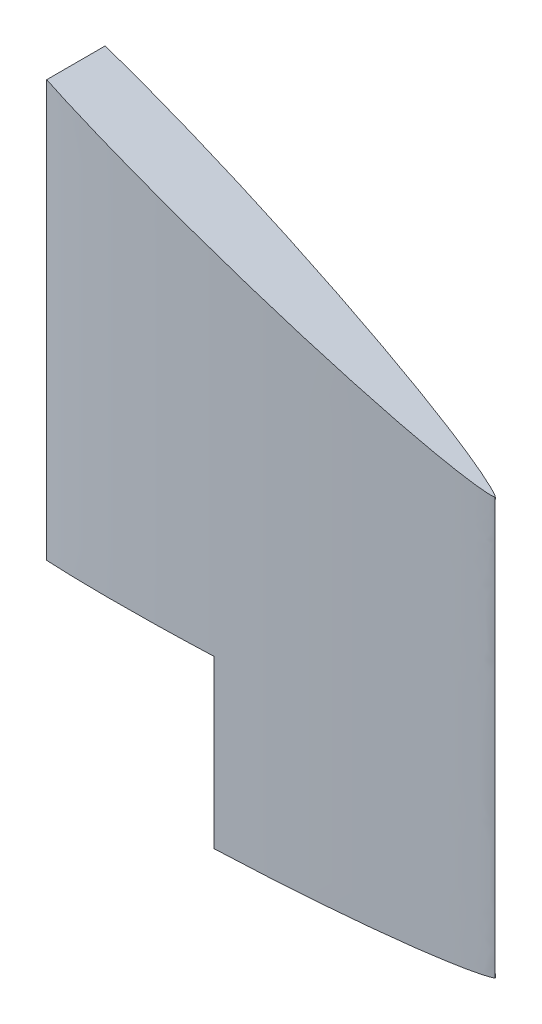
from build123d import *

# Parameters (mm, degrees)
EXTRUDE_2_DEPTH          = 100
CUT_EXTRUDE_1_DEPTH      = 100
CUT_EXTRUDE_1_DEPTH_BACK = 100
CUT_EXTRUDE_2_DEPTH      = 100
CUT_EXTRUDE_2_DEPTH_BACK = 100
SKETCH_7_R               = 2.5
CUT_EXTRUDE_3_DEPTH      = 4
SKETCH_9_W               = 5
SKETCH_9_H               = 2
CUT_EXTRUDE_5_DEPTH      = 50
SKETCH_11_W              = 1
SKETCH_11_H              = 5
CUT_EXTRUDE_6_DEPTH      = 70


with BuildPart() as part:
    # 草图1 → 凸台-拉伸2 (new body)
    with BuildSketch(Plane(origin=(0, 0, 0), x_dir=(1, 0, 0), z_dir=(0, 1, 0))):
        with BuildLine():
            Line((0, 3.5), (0, -3.5))
            add(Edge.make_bspline(
                [(50.366159274, 0), (50.361611856, -0.007626809), (50.351204479, -0.02006437), (50.331882619, -0.034590016), (50.303550644, -0.054206105), (50.267550201, -0.075556608), (50.212502865, -0.10497516), (50.119653298, -0.148566943), (49.957819519, -0.214752734), (49.665215675, -0.317523283), (49.13925125, -0.473472151), (48.270224034, -0.688745908), (46.70823084, -1.011640024), (44.506574683, -1.380432353), (41.778946661, -1.759931683), (38.652126132, -2.124759538), (35.514265565, -2.438710467), (32.372435692, -2.710036408), (29.227679081, -2.944564854), (26.08060135, -3.145565261), (22.931686571, -3.315201685), (19.781279338, -3.454355095), (16.629676417, -3.563265326), (13.477153227, -3.64092263), (10.32396772, -3.685707952), (7.170479651, -3.693560136), (4.194558842, -3.660897819), (2.007697821, -3.59990808), (0.60968903, -3.538531774), (0, -3.5)],
                knots=[0, 0, 0, 0, 0, 0.00069899, 0.001287975, 0.00188024, 0.002733393, 0.003996075, 0.006218737, 0.009974212, 0.016536224, 0.028474968, 0.049524397, 0.080651233, 0.142462147, 0.204715828, 0.26696952, 0.329223211, 0.391476901, 0.453730594, 0.515984286, 0.578237977, 0.640491669, 0.70274536, 0.764999052, 0.827252742, 0.889506435, 0.951760127, 1, 1, 1, 1, 1], degree=4))
            add(Edge.make_bspline(
                [(50.366159274, 0), (50.361611856, 0.007626809), (50.351204479, 0.02006437), (50.331882619, 0.034590016), (50.303550644, 0.054206105), (50.267550201, 0.075556608), (50.212502865, 0.10497516), (50.119653298, 0.148566943), (49.957819519, 0.214752734), (49.665215675, 0.317523283), (49.13925125, 0.473472151), (48.270224034, 0.688745908), (46.70823084, 1.011640024), (44.506574683, 1.380432353), (41.778946661, 1.759931683), (38.652126132, 2.124759538), (35.514265565, 2.438710467), (32.372435692, 2.710036408), (29.227679081, 2.944564854), (26.08060135, 3.145565261), (22.931686571, 3.315201685), (19.781279338, 3.454355095), (16.629676417, 3.563265326), (13.477153227, 3.64092263), (10.32396772, 3.685707952), (7.170479651, 3.693560136), (4.194558842, 3.660897819), (2.007697821, 3.59990808), (0.60968903, 3.538531774), (0, 3.5)],
                knots=[0, 0, 0, 0, 0, 0.00069899, 0.001287975, 0.00188024, 0.002733393, 0.003996075, 0.006218737, 0.009974212, 0.016536224, 0.028474968, 0.049524397, 0.080651233, 0.142462147, 0.204715828, 0.26696952, 0.329223211, 0.391476901, 0.453730594, 0.515984286, 0.578237977, 0.640491669, 0.70274536, 0.764999052, 0.827252742, 0.889506435, 0.951760127, 1, 1, 1, 1, 1], degree=4))
        make_face()
    extrude(amount=EXTRUDE_2_DEPTH)

    # 草图3 → 切除-拉伸1 (cut, two sides: drawn at the far end of the back side and taken through both)
    with BuildSketch(Plane.XY.offset(-CUT_EXTRUDE_1_DEPTH_BACK)):
        Polygon((50.366159274, 100), (50.366159274, 80), (0, 100), align=None)
        Polygon((50.366159274, 0), (50.366159274, 20), (0, 0), align=None)
    extrude(amount=CUT_EXTRUDE_1_DEPTH + CUT_EXTRUDE_1_DEPTH_BACK, mode=Mode.SUBTRACT)

    # 草图6 → 切除-拉伸2 (cut, two sides: drawn at the far end of the back side and taken through both)
    with BuildSketch(Plane.XY.offset(-CUT_EXTRUDE_2_DEPTH_BACK)):
        Polygon((0, 50), (20, 50), (20, 30), (50.366159274, 30), (50.366159274, 20), (0, 0), align=None)
    extrude(amount=CUT_EXTRUDE_2_DEPTH + CUT_EXTRUDE_2_DEPTH_BACK, mode=Mode.SUBTRACT)

    # 草图7 → 切除-拉伸3 (cut)
    with BuildSketch(Plane(origin=(0, 0, 0), x_dir=(0, 0, -1), z_dir=(1, 0, 0))):
        with Locations((0, 50)):
            Circle(SKETCH_7_R)
    extrude(amount=CUT_EXTRUDE_3_DEPTH, mode=Mode.SUBTRACT)

    # 草图9 → 切除-拉伸5 (cut)
    with BuildSketch(Plane(origin=(0, 0, 0), x_dir=(1, 0, 0), z_dir=(0, 1, 0))):
        with Locations((22.5, 0)):
            Rectangle(SKETCH_9_W, SKETCH_9_H)
    extrude(amount=CUT_EXTRUDE_5_DEPTH, mode=Mode.SUBTRACT)

    # 草图11 → 切除-拉伸6 (cut)
    with BuildSketch(Plane(origin=(0, 0, 0), x_dir=(1, 0, 0), z_dir=(0, 1, 0))):
        with Locations((3.5, 0)):
            Rectangle(SKETCH_11_W, SKETCH_11_H)
    extrude(amount=CUT_EXTRUDE_6_DEPTH, mode=Mode.SUBTRACT)


solid = part.part
